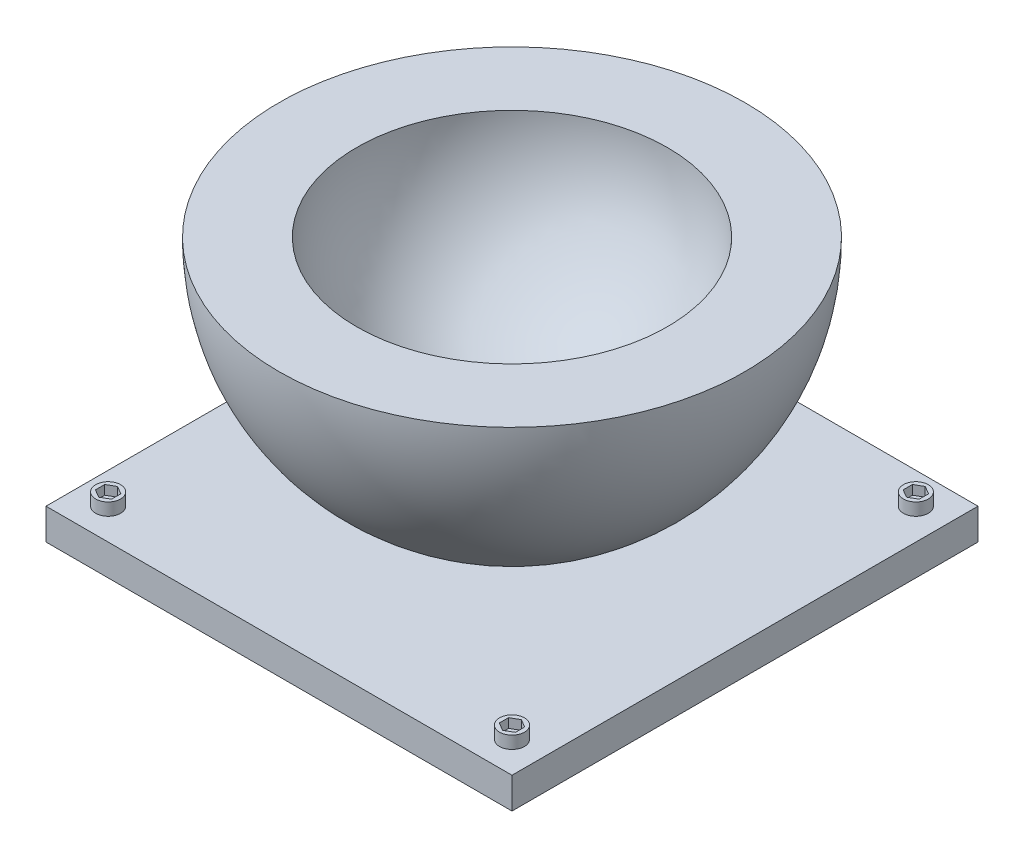
from build123d import *

# Parameters (mm, degrees)
REVOLVE3_ANGLE          = 180
SKETCH2_W               = 75
SKETCH2_H               = 75
BOSS_EXTRUDE1_DEPTH     = 5
SKETCH3_R               = 1.5
CUT_EXTRUDE1_DEPTH      = 5
SKETCH4_R               = 2
BOSS_EXTRUDE2_DEPTH     = 2
CUT_EXTRUDE2_DEPTH      = 1.5
BOSS_EXTRUDE3_REACH     = 69.961
SKETCH6_R               = 1.5
MIRROR2_COPY_1_SKETCH_R = 1.5
MIRROR2_COPY_1_DEPTH    = 5
MIRROR2_COPY_2_SKETCH_R = 2
MIRROR2_COPY_2_DEPTH    = 2
MIRROR2_COPY_3_DEPTH    = 1.5
MIRROR2_COPY_4_REACH    = 69.961
MIRROR2_COPY_4_SKETCH_R = 1.5
MIRROR2_COPY_5_SKETCH_R = 1.5
MIRROR2_COPY_5_DEPTH    = 5
MIRROR2_COPY_6_REACH    = 69.961
MIRROR2_COPY_6_SKETCH_R = 1.5


with BuildPart() as part:
    # Sketch1 → Revolve3 (revolve)
    with BuildSketch(Plane(origin=(0, 0, 0), x_dir=(1, 0, 0), z_dir=(0, 1, 0))):
        with BuildLine():
            Line((0, 25), (0, 37.5))
            ThreePointArc((0, 37.5), (-37.5, 0), (0, -37.5))
            Line((0, -37.5), (0, -25))
            ThreePointArc((0, -25), (-25, 0), (0, 25))
        make_face()
    revolve(axis=Axis((0, 0, -18.61408832), (0, 0, 1)), revolution_arc=REVOLVE3_ANGLE)


with BuildPart() as body_2:
    # Sketch2 → Boss-Extrude1 (new body)
    with BuildSketch(Plane(origin=(0, -37.5, 0), x_dir=(-1, 0, 0), z_dir=(0, -1, 0))):
        Rectangle(SKETCH2_W, SKETCH2_H)
    extrude(amount=BOSS_EXTRUDE1_DEPTH)

    # Sketch3 → Cut-Extrude1 (cut)
    with BuildSketch(Plane(origin=(0, -37.5, 0), x_dir=(1, 0, 0), z_dir=(0, 1, 0))):
        with Locations(Location((32.5, -32.5, 0), (0, 0, 180))):
            Circle(SKETCH3_R)
    cut_extrude1 = extrude(amount=-CUT_EXTRUDE1_DEPTH, mode=Mode.SUBTRACT)

    # Sketch4 → Boss-Extrude2 (add)
    with BuildSketch(Plane(origin=(0, -37.5, 0), x_dir=(1, 0, 0), z_dir=(0, 1, 0))):
        with Locations((32.5, -32.5)):
            Circle(SKETCH4_R)
    boss_extrude2 = extrude(amount=BOSS_EXTRUDE2_DEPTH)

    # Sketch5 → Cut-Extrude2 (cut)
    with BuildSketch(Plane(origin=(0, -35.5, 0), x_dir=(1, 0, 0), z_dir=(0, 1, 0))):
        Polygon((31.200961894, -31.75), (31.200961894, -33.25), (32.5, -34), (33.799038106, -33.25), (33.799038106, -31.75), (32.5, -31), align=None)
    cut_extrude2 = extrude(amount=-CUT_EXTRUDE2_DEPTH, mode=Mode.SUBTRACT)

    # Sketch6 → Boss-Extrude3 (add, up to next)
    with BuildSketch(Plane.XZ.offset(42.5), mode=Mode.PRIVATE) as boss_extrude3_sk1:
        with Locations((32.5, 32.5)):
            Circle(SKETCH6_R)
    boss_extrude3_tool1 = extrude(boss_extrude3_sk1.sketch, amount=-BOSS_EXTRUDE3_REACH, mode=Mode.PRIVATE) - body_2.part
    boss_extrude3 = boss_extrude3_tool1.solids().sort_by_distance((32.5, -42.5, 32.5))[0]
    add(boss_extrude3)

    # Mirror1: Cut-Extrude1, Boss-Extrude2, Cut-Extrude2, Boss-Extrude3 across plane
    add(cut_extrude1.mirror(Plane.XY), mode=Mode.SUBTRACT)
    add(boss_extrude2.mirror(Plane.XY))
    add(cut_extrude2.mirror(Plane.XY), mode=Mode.SUBTRACT)
    add(boss_extrude3.mirror(Plane.XY))

    # Mirror2: Boss-Extrude2, Cut-Extrude2 across plane
    add(boss_extrude2.mirror(Plane(origin=(0, 0, 0), x_dir=(0, 0, 1), z_dir=(1, 0, 0))))
    add(cut_extrude2.mirror(Plane(origin=(0, 0, 0), x_dir=(0, 0, 1), z_dir=(1, 0, 0))), mode=Mode.SUBTRACT)

    # Mirror2 copy 1 sketch → Mirror2 copy 1 (cut)
    with BuildSketch(Plane(origin=(0, -37.5, 0), x_dir=(-1, 0, 0), z_dir=(0, 1, 0))):
        with Locations(Location((32.5, -32.5, 0), (0, 0, 180))):
            Circle(MIRROR2_COPY_1_SKETCH_R)
    extrude(amount=-MIRROR2_COPY_1_DEPTH, mode=Mode.SUBTRACT)

    # Mirror2 copy 2 sketch → Mirror2 copy 2 (add)
    with BuildSketch(Plane(origin=(0, -37.5, 0), x_dir=(-1, 0, 0), z_dir=(0, 1, 0))):
        with Locations((32.5, -32.5)):
            Circle(MIRROR2_COPY_2_SKETCH_R)
    extrude(amount=MIRROR2_COPY_2_DEPTH)

    # Mirror2 copy 3 sketch → Mirror2 copy 3 (cut)
    with BuildSketch(Plane(origin=(0, -35.5, 0), x_dir=(-1, 0, 0), z_dir=(0, 1, 0))):
        Polygon((31.200961894, -31.75), (31.200961894, -33.25), (32.5, -34), (33.799038106, -33.25), (33.799038106, -31.75), (32.5, -31), align=None)
    extrude(amount=-MIRROR2_COPY_3_DEPTH, mode=Mode.SUBTRACT)

    # Mirror2 copy 4 sketch → Mirror2 copy 4 (add, up to next)
    with BuildSketch(Plane(origin=(0, -42.5, 0), x_dir=(-1, 0, 0), z_dir=(0, -1, 0)), mode=Mode.PRIVATE) as mirror2_copy_4_sk1:
        with Locations((32.5, 32.5)):
            Circle(MIRROR2_COPY_4_SKETCH_R)
    mirror2_copy_4_tool1 = extrude(mirror2_copy_4_sk1.sketch, amount=-MIRROR2_COPY_4_REACH, mode=Mode.PRIVATE) - body_2.part
    add(mirror2_copy_4_tool1.solids().sort_by_distance((-32.5, -42.5, -32.5))[0])

    # Mirror2 copy 5 sketch → Mirror2 copy 5 (cut)
    with BuildSketch(Plane(origin=(0, -37.5, 0), x_dir=(-1, 0, 0), z_dir=(0, 1, 0))):
        with Locations((32.5, 32.5)):
            Circle(MIRROR2_COPY_5_SKETCH_R)
    extrude(amount=-MIRROR2_COPY_5_DEPTH, mode=Mode.SUBTRACT)

    # Mirror2 copy 6 sketch → Mirror2 copy 6 (add, up to next)
    with BuildSketch(Plane(origin=(0, -42.5, 0), x_dir=(-1, 0, 0), z_dir=(0, -1, 0)), mode=Mode.PRIVATE) as mirror2_copy_6_sk1:
        with Locations((32.5, -32.5)):
            Circle(MIRROR2_COPY_6_SKETCH_R)
    mirror2_copy_6_tool1 = extrude(mirror2_copy_6_sk1.sketch, amount=-MIRROR2_COPY_6_REACH, mode=Mode.PRIVATE) - body_2.part
    add(mirror2_copy_6_tool1.solids().sort_by_distance((-32.5, -42.5, 32.5))[0])


solid = Compound([part.part, body_2.part])
